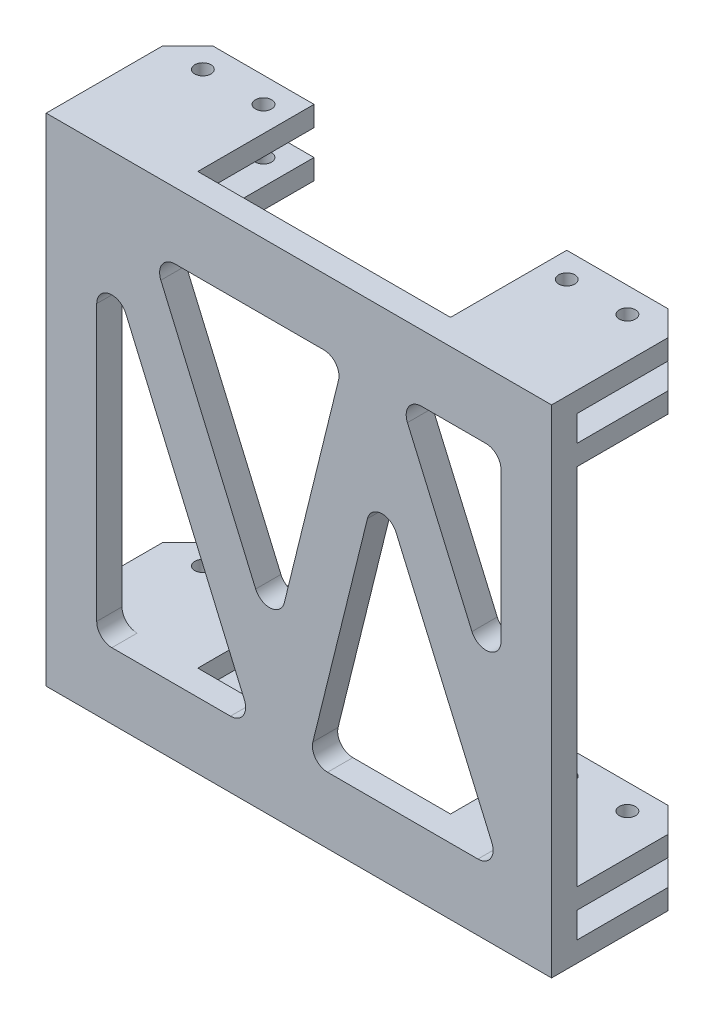
from build123d import *

# Parameters (mm, degrees)
SKETCH_1_W          = 100
SKETCH_1_H          = 98.2
EXTRUDE_1_DEPTH     = 5
SKETCH_2_W          = 25
SKETCH_2_H          = 4
EXTRUDE_2_DEPTH     = 23
CHAMFER_1_SIZE      = 5
SKETCH_3_R          = 1.6
CUT_EXTRUDE_1_DEPTH = 100


with BuildPart() as part:
    # 草图1 → 凸台-拉伸1 (new body)
    with BuildSketch(Plane.XY):
        with Locations((-210.886237356, -45)):
            Rectangle(SKETCH_1_W, SKETCH_1_H)
        with BuildLine():
            ThreePointArc((-245.131057565, -22.358440495), (-248.492232664, -20.607289414), (-250.886237356, -23.545446947))
            Line((-250.886237356, -23.545446947), (-250.886237356, -78))
            ThreePointArc((-250.886237356, -78), (-250.0075577, -80.121320344), (-247.886237356, -81))
            Line((-247.886237356, -81), (-224.42573361, -81))
            ThreePointArc((-224.42573361, -81), (-221.919639103, -79.649087724), (-221.670553819, -76.812993548))
            Line((-221.670553819, -76.812993548), (-245.131057565, -22.358440495))
        make_face(mode=Mode.SUBTRACT)
        with BuildLine():
            ThreePointArc((-191.655684006, -33.128922342), (-194.657829236, -31.333405344), (-197.320051564, -33.602618764))
            Line((-197.320051564, -33.602618764), (-208.123721184, -77.279649032))
            ThreePointArc((-208.123721184, -77.279649032), (-207.573803103, -79.849181859), (-205.211489311, -81))
            Line((-205.211489311, -81), (-175.458011282, -81))
            ThreePointArc((-175.458011282, -81), (-172.949810516, -79.645882413), (-172.705875596, -76.805952611))
            Line((-172.705875596, -76.805952611), (-191.655684006, -33.128922342))
        make_face(mode=Mode.SUBTRACT)
        with BuildLine():
            ThreePointArc((-176.638373042, -42.617387799), (-173.276486201, -44.360720795), (-170.886237356, -41.42334041))
            Line((-170.886237356, -41.42334041), (-170.886237356, -12))
            ThreePointArc((-170.886237356, -12), (-171.764917013, -9.878679656), (-173.886237356, -9))
            Line((-173.886237356, -9), (-186.651909841, -9))
            ThreePointArc((-186.651909841, -9), (-189.160110607, -10.354117587), (-189.404045527, -13.194047389))
            Line((-189.404045527, -13.194047389), (-176.638373042, -42.617387799))
        make_face(mode=Mode.SUBTRACT)
        with BuildLine():
            Line((-203.040454286, -12.717792993), (-213.768880163, -56.2546336))
            ThreePointArc((-213.768880163, -56.2546336), (-216.43424337, -58.526613784), (-219.43692336, -56.723847059))
            Line((-219.43692336, -56.723847059), (-238.193779397, -13.187006452))
            ThreePointArc((-238.193779397, -13.187006452), (-237.944694112, -10.350912276), (-235.438599605, -9))
            Line((-235.438599605, -9), (-205.953317692, -9))
            ThreePointArc((-205.953317692, -9), (-203.591816159, -10.149780956), (-203.040454286, -12.717792993))
        make_face(mode=Mode.SUBTRACT)
    extrude(amount=EXTRUDE_1_DEPTH)

    # 草图2 → 凸台-拉伸2 (add)
    with BuildSketch(Plane(origin=(0, 0, 0), x_dir=(-1, 0, 0), z_dir=(0, 0, -1))):
        with Locations((248.386237356, 2.1)):
            Rectangle(SKETCH_2_W, SKETCH_2_H)
        with Locations((248.386237356, -7)):
            Rectangle(SKETCH_2_W, SKETCH_2_H)
        with Locations((173.386237356, -7)):
            Rectangle(SKETCH_2_W, SKETCH_2_H)
        with Locations((173.386237356, 2.1)):
            Rectangle(SKETCH_2_W, SKETCH_2_H)
        with Locations((173.386237356, -92.1)):
            Rectangle(SKETCH_2_W, SKETCH_2_H)
        with Locations((173.386237356, -83)):
            Rectangle(SKETCH_2_W, SKETCH_2_H)
        with Locations((248.386237356, -83)):
            Rectangle(SKETCH_2_W, SKETCH_2_H)
        with Locations((248.386237356, -92.1)):
            Rectangle(SKETCH_2_W, SKETCH_2_H)
    extrude(amount=EXTRUDE_2_DEPTH)

    # 倒角1
    chamfer_1_edges = [part.edges().sort_by_distance(p)[0] for p in [
        (-160.886237356, -7, -23),
        (-160.886237356, 2.1, -23),
        (-160.886237356, -92.1, -23),
        (-160.886237356, -83, -23),
        (-260.886237356, -83, -23),
        (-260.886237356, -92.1, -23),
        (-260.886237356, 2.1, -23),
        (-260.886237356, -7, -23),
    ]]
    chamfer(chamfer_1_edges, length=CHAMFER_1_SIZE)

    # 草图3 → 切除-拉伸1 (cut)
    with BuildSketch(Plane(origin=(0, 4.1, 0), x_dir=(1, 0, 0), z_dir=(0, 1, 0))):
        with Locations(Location((-252.886237356, 18, 0), (0, 0, 270))):
            Circle(SKETCH_3_R)
        with Locations(Location((-240.886237356, 18, 0), (0, 0, 270))):
            Circle(SKETCH_3_R)
        with Locations(Location((-180.886237356, 18, 0), (0, 0, 180))):
            Circle(SKETCH_3_R)
        with Locations(Location((-168.886237356, 18, 0), (0, 0, 180))):
            Circle(SKETCH_3_R)
    extrude(amount=-CUT_EXTRUDE_1_DEPTH, mode=Mode.SUBTRACT)


solid = part.part
